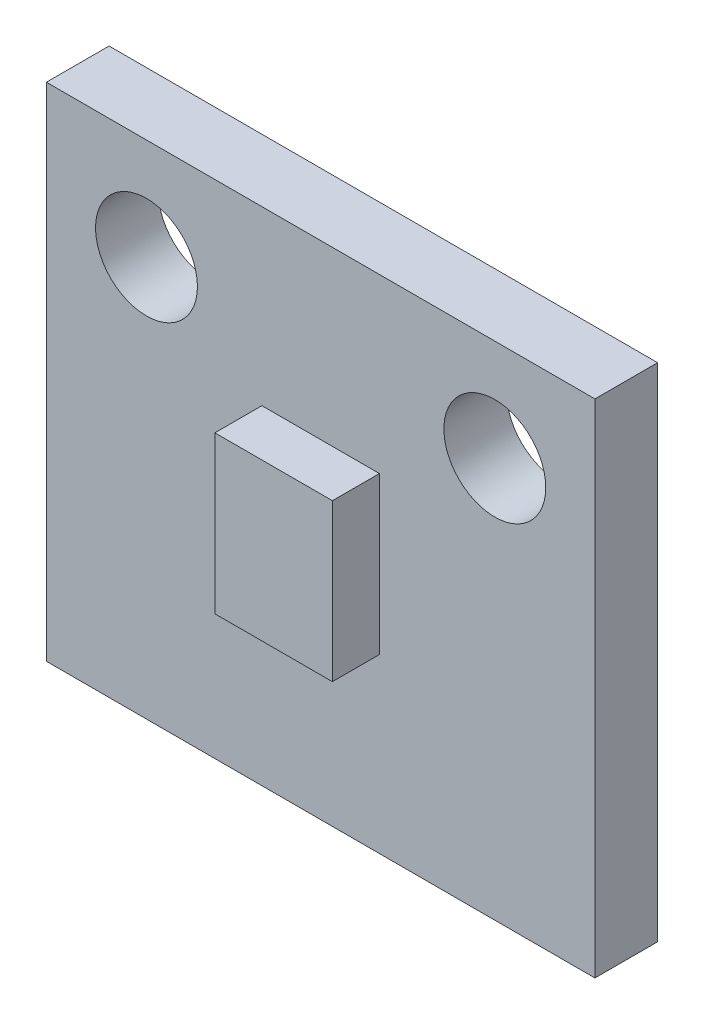
from build123d import *

# Parameters (mm, degrees)
V10_MIC_14X12P8_PCB_START               = -9
SKETCH_4_W                              = 14
SKETCH_4_H                              = 12.8
V10_MIC_14X12P8_PCB_DEPTH               = 1.6
V10_MIC_SOUND_PACKAGE_FACING_LID_START  = -7.4
SKETCH_5_W                              = 3
SKETCH_5_H                              = 4
V10_MIC_SOUND_PACKAGE_FACING_LID_DEPTH  = 1.2
SKETCH_6_R                              = 1.3
V10_MIC_REFERENCE_HOLES_PITCH8P89_DEPTH = 1.6


with BuildPart() as part:
    # 草图4 → V10_MIC_14x12p8_pcb (new body)
    with BuildSketch(Plane.XY.offset(V10_MIC_14X12P8_PCB_START)):
        with Locations((65, 33)):
            Rectangle(SKETCH_4_W, SKETCH_4_H)
    extrude(amount=V10_MIC_14X12P8_PCB_DEPTH)

    # 草图5 → V10_MIC_sound_package_facing_lid (add)
    with BuildSketch(Plane.XY.offset(V10_MIC_SOUND_PACKAGE_FACING_LID_START)):
        with Locations((65, 33)):
            Rectangle(SKETCH_5_W, SKETCH_5_H)
    extrude(amount=V10_MIC_SOUND_PACKAGE_FACING_LID_DEPTH)

    # 草图6 → V10_MIC_reference_holes_pitch8p89 (cut)
    with BuildSketch(Plane.XY.offset(-7.4)):
        with Locations((60.555, 36.81)):
            Circle(SKETCH_6_R)
        with Locations((69.445, 36.81)):
            Circle(SKETCH_6_R)
    extrude(amount=-V10_MIC_REFERENCE_HOLES_PITCH8P89_DEPTH, mode=Mode.SUBTRACT)


solid = part.part
